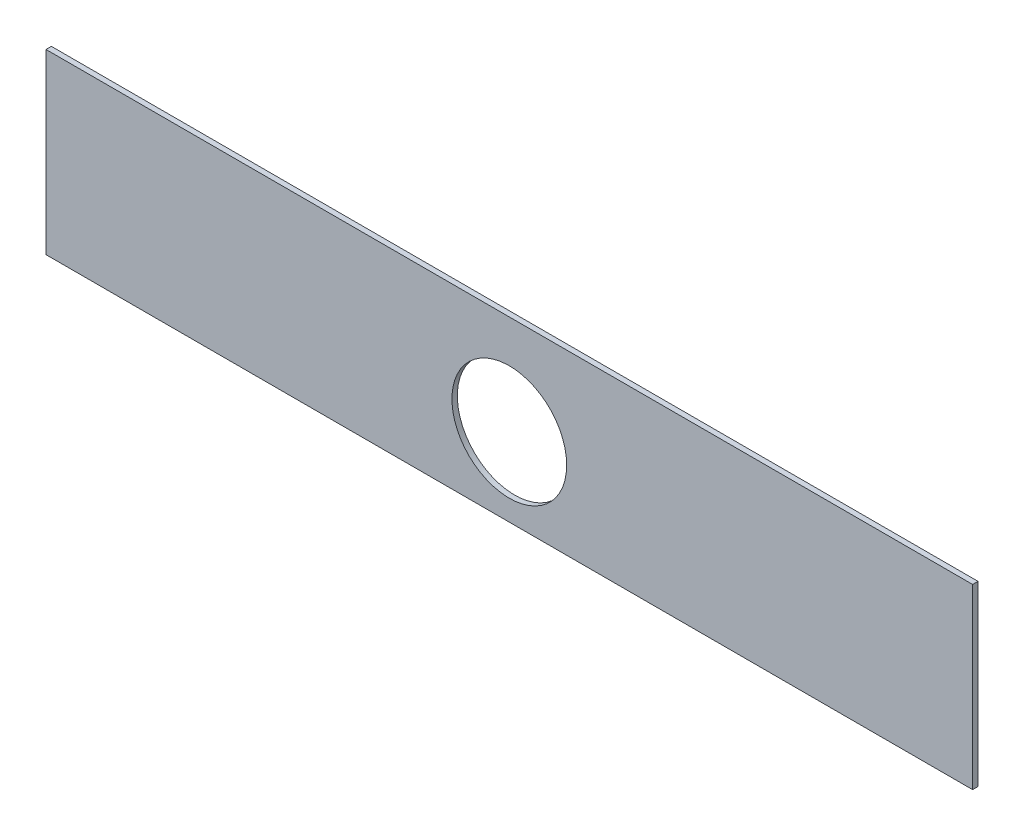
from build123d import *

# Parameters (mm, degrees)
SKETCH1_W           = 172.05
SKETCH1_H           = 33
SKETCH1_R           = 10.65
BOSS_EXTRUDE1_DEPTH = 1


with BuildPart() as part:
    # Sketch1 → Boss-Extrude1 (new body)
    with BuildSketch(Plane.XY):
        with Locations((86.025, 16.5)):
            Rectangle(SKETCH1_W, SKETCH1_H)
        with Locations((86.025, 14.5)):
            Circle(SKETCH1_R, mode=Mode.SUBTRACT)
    extrude(amount=BOSS_EXTRUDE1_DEPTH)


solid = part.part
